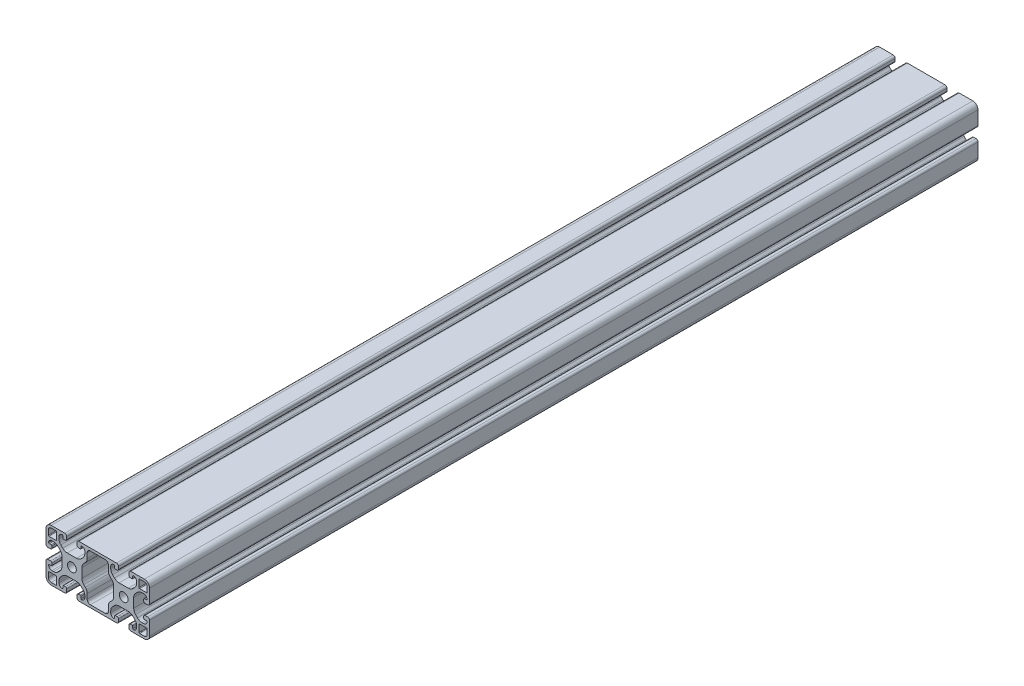
from build123d import *

# Parameters (mm, degrees)
ESQUISSE1_R        = 3.4
BOSS_EXTRU_1_DEPTH = 640


with BuildPart() as part:
    # Esquisse1 → Boss.-Extru.1 (new body)
    with BuildSketch(Plane.XY.offset(20)):
        with BuildLine():
            Line((66.5, 4.5), (65, 4.5))
            ThreePointArc((65, 4.5), (64.292893219, 4.207106781), (64, 3.5))
            Line((64, 3.5), (64, 1.5))
            ThreePointArc((64, 1.5), (64.439339828, 0.439339828), (65.5, 0))
            Line((65.5, 0), (76, 0))
            ThreePointArc((76, 0), (78.828427125, 1.171572875), (80, 4))
            Line((80, 4), (80, 14.5))
            ThreePointArc((80, 14.5), (79.560660172, 15.560660172), (78.5, 16))
            Line((78.5, 16), (76.5, 16))
            ThreePointArc((76.5, 16), (75.792893219, 15.707106781), (75.5, 15))
            Line((75.5, 15), (75.5, 13.5))
            ThreePointArc((75.5, 13.5), (75.646446609, 13.146446609), (76, 13))
            Line((76, 13), (77.5, 13))
            ThreePointArc((77.5, 13), (77.853553391, 12.853553391), (78, 12.5))
            ThreePointArc((78, 12.5), (77.267766953, 10.732233047), (75.5, 10))
            Line((75.5, 10), (74.192388155, 10))
            ThreePointArc((74.192388155, 10), (72.278970994, 10.380602337), (70.656854249, 11.464466094))
            Line((70.656854249, 11.464466094), (69.214466094, 12.906854249))
            ThreePointArc((69.214466094, 12.906854249), (68.130602337, 14.528970994), (67.75, 16.442388155))
            Line((67.75, 16.442388155), (67.75, 23.557611845))
            ThreePointArc((67.75, 23.557611845), (68.130602337, 25.471029006), (69.214466094, 27.093145751))
            Line((69.214466094, 27.093145751), (70.656854249, 28.535533906))
            ThreePointArc((70.656854249, 28.535533906), (72.278970994, 29.619397663), (74.192388155, 30))
            Line((74.192388155, 30), (75.5, 30))
            ThreePointArc((75.5, 30), (77.267766953, 29.267766953), (78, 27.5))
            ThreePointArc((78, 27.5), (77.853553391, 27.146446609), (77.5, 27))
            Line((77.5, 27), (76, 27))
            ThreePointArc((76, 27), (75.646446609, 26.853553391), (75.5, 26.5))
            Line((75.5, 26.5), (75.5, 25))
            ThreePointArc((75.5, 25), (75.792893219, 24.292893219), (76.5, 24))
            Line((76.5, 24), (78.5, 24))
            ThreePointArc((78.5, 24), (79.560660172, 24.439339828), (80, 25.5))
            Line((80, 25.5), (80, 36))
            ThreePointArc((80, 36), (78.828427125, 38.828427125), (76, 40))
            Line((76, 40), (65.5, 40))
            ThreePointArc((65.5, 40), (64.439339828, 39.560660172), (64, 38.5))
            Line((64, 38.5), (64, 36.5))
            ThreePointArc((64, 36.5), (64.292893219, 35.792893219), (65, 35.5))
            Line((65, 35.5), (66.5, 35.5))
            ThreePointArc((66.5, 35.5), (66.853553391, 35.646446609), (67, 36))
            Line((67, 36), (67, 37.5))
            ThreePointArc((67, 37.5), (67.146446609, 37.853553391), (67.5, 38))
            ThreePointArc((67.5, 38), (69.267766953, 37.267766953), (70, 35.5))
            Line((70, 35.5), (70, 34.192388155))
            ThreePointArc((70, 34.192388155), (69.619397663, 32.278970994), (68.535533906, 30.656854249))
            Line((68.535533906, 30.656854249), (67.093145751, 29.214466094))
            ThreePointArc((67.093145751, 29.214466094), (65.471029006, 28.130602337), (63.557611845, 27.75))
            Line((63.557611845, 27.75), (56.442388155, 27.75))
            ThreePointArc((56.442388155, 27.75), (54.528970994, 28.130602337), (52.906854249, 29.214466094))
            Line((52.906854249, 29.214466094), (51.464466094, 30.656854249))
            ThreePointArc((51.464466094, 30.656854249), (50.380602337, 32.278970994), (50, 34.192388155))
            Line((50, 34.192388155), (50, 35.5))
            ThreePointArc((50, 35.5), (50.732233047, 37.267766953), (52.5, 38))
            ThreePointArc((52.5, 38), (52.853553391, 37.853553391), (53, 37.5))
            Line((53, 37.5), (53, 36))
            ThreePointArc((53, 36), (53.146446609, 35.646446609), (53.5, 35.5))
            Line((53.5, 35.5), (55, 35.5))
            ThreePointArc((55, 35.5), (55.707106781, 35.792893219), (56, 36.5))
            Line((56, 36.5), (56, 38.5))
            ThreePointArc((56, 38.5), (55.560660172, 39.560660172), (54.5, 40))
            Line((54.5, 40), (25.5, 40))
            ThreePointArc((25.5, 40), (24.439339828, 39.560660172), (24, 38.5))
            Line((24, 38.5), (24, 36.5))
            ThreePointArc((24, 36.5), (24.292893219, 35.792893219), (25, 35.5))
            Line((25, 35.5), (26.5, 35.5))
            ThreePointArc((26.5, 35.5), (26.853553391, 35.646446609), (27, 36))
            Line((27, 36), (27, 37.5))
            ThreePointArc((27, 37.5), (27.146446609, 37.853553391), (27.5, 38))
            ThreePointArc((27.5, 38), (29.267766953, 37.267766953), (30, 35.5))
            Line((30, 35.5), (30, 34.192388155))
            ThreePointArc((30, 34.192388155), (29.619397663, 32.278970994), (28.535533906, 30.656854249))
            Line((28.535533906, 30.656854249), (27.093145751, 29.214466094))
            ThreePointArc((27.093145751, 29.214466094), (25.471029006, 28.130602337), (23.557611845, 27.75))
            Line((23.557611845, 27.75), (16.442388155, 27.75))
            ThreePointArc((16.442388155, 27.75), (14.528970994, 28.130602337), (12.906854249, 29.214466094))
            Line((12.906854249, 29.214466094), (11.464466094, 30.656854249))
            ThreePointArc((11.464466094, 30.656854249), (10.380602337, 32.278970994), (10, 34.192388155))
            Line((10, 34.192388155), (10, 35.5))
            ThreePointArc((10, 35.5), (10.732233047, 37.267766953), (12.5, 38))
            ThreePointArc((12.5, 38), (12.853553391, 37.853553391), (13, 37.5))
            Line((13, 37.5), (13, 36))
            ThreePointArc((13, 36), (13.146446609, 35.646446609), (13.5, 35.5))
            Line((13.5, 35.5), (15, 35.5))
            ThreePointArc((15, 35.5), (15.707106781, 35.792893219), (16, 36.5))
            Line((16, 36.5), (16, 38.5))
            ThreePointArc((16, 38.5), (15.560660172, 39.560660172), (14.5, 40))
            Line((14.5, 40), (4, 40))
            ThreePointArc((4, 40), (1.171572875, 38.828427125), (0, 36))
            Line((0, 36), (0, 25.5))
            ThreePointArc((0, 25.5), (0.439339828, 24.439339828), (1.5, 24))
            Line((1.5, 24), (3.5, 24))
            ThreePointArc((3.5, 24), (4.207106781, 24.292893219), (4.5, 25))
            Line((4.5, 25), (4.5, 26.5))
            ThreePointArc((4.5, 26.5), (4.353553391, 26.853553391), (4, 27))
            Line((4, 27), (2.5, 27))
            ThreePointArc((2.5, 27), (2.146446609, 27.146446609), (2, 27.5))
            ThreePointArc((2, 27.5), (2.732233047, 29.267766953), (4.5, 30))
            Line((4.5, 30), (5.807611845, 30))
            ThreePointArc((5.807611845, 30), (7.721029006, 29.619397663), (9.343145751, 28.535533906))
            Line((9.343145751, 28.535533906), (10.785533906, 27.093145751))
            ThreePointArc((10.785533906, 27.093145751), (11.869397663, 25.471029006), (12.25, 23.557611845))
            Line((12.25, 23.557611845), (12.25, 16.442388155))
            ThreePointArc((12.25, 16.442388155), (11.869397663, 14.528970994), (10.785533906, 12.906854249))
            Line((10.785533906, 12.906854249), (9.343145751, 11.464466094))
            ThreePointArc((9.343145751, 11.464466094), (7.721029006, 10.380602337), (5.807611845, 10))
            Line((5.807611845, 10), (4.5, 10))
            ThreePointArc((4.5, 10), (2.732233047, 10.732233047), (2, 12.5))
            ThreePointArc((2, 12.5), (2.146446609, 12.853553391), (2.5, 13))
            Line((2.5, 13), (4, 13))
            ThreePointArc((4, 13), (4.353553391, 13.146446609), (4.5, 13.5))
            Line((4.5, 13.5), (4.5, 15))
            ThreePointArc((4.5, 15), (4.207106781, 15.707106781), (3.5, 16))
            Line((3.5, 16), (1.5, 16))
            ThreePointArc((1.5, 16), (0.439339828, 15.560660172), (0, 14.5))
            Line((0, 14.5), (0, 4))
            ThreePointArc((0, 4), (1.171572875, 1.171572875), (4, 0))
            Line((4, 0), (14.5, 0))
            ThreePointArc((14.5, 0), (15.560660172, 0.439339828), (16, 1.5))
            Line((16, 1.5), (16, 3.5))
            ThreePointArc((16, 3.5), (15.707106781, 4.207106781), (15, 4.5))
            Line((15, 4.5), (13.5, 4.5))
            ThreePointArc((13.5, 4.5), (13.146446609, 4.353553391), (13, 4))
            Line((13, 4), (13, 2.5))
            ThreePointArc((13, 2.5), (12.853553391, 2.146446609), (12.5, 2))
            ThreePointArc((12.5, 2), (10.732233047, 2.732233047), (10, 4.5))
            Line((10, 4.5), (10, 5.807611845))
            ThreePointArc((10, 5.807611845), (10.380602337, 7.721029006), (11.464466094, 9.343145751))
            Line((11.464466094, 9.343145751), (12.906854249, 10.785533906))
            ThreePointArc((12.906854249, 10.785533906), (14.528970994, 11.869397663), (16.442388155, 12.25))
            Line((16.442388155, 12.25), (23.557611845, 12.25))
            ThreePointArc((23.557611845, 12.25), (25.471029006, 11.869397663), (27.093145751, 10.785533906))
            Line((27.093145751, 10.785533906), (28.535533906, 9.343145751))
            ThreePointArc((28.535533906, 9.343145751), (29.619397663, 7.721029006), (30, 5.807611845))
            Line((30, 5.807611845), (30, 4.5))
            ThreePointArc((30, 4.5), (29.267766953, 2.732233047), (27.5, 2))
            ThreePointArc((27.5, 2), (27.146446609, 2.146446609), (27, 2.5))
            Line((27, 2.5), (27, 4))
            ThreePointArc((27, 4), (26.853553391, 4.353553391), (26.5, 4.5))
            Line((26.5, 4.5), (25, 4.5))
            ThreePointArc((25, 4.5), (24.292893219, 4.207106781), (24, 3.5))
            Line((24, 3.5), (24, 1.5))
            ThreePointArc((24, 1.5), (24.439339828, 0.439339828), (25.5, 0))
            Line((25.5, 0), (54.5, 0))
            ThreePointArc((54.5, 0), (55.560660172, 0.439339828), (56, 1.5))
            Line((56, 1.5), (56, 3.5))
            ThreePointArc((56, 3.5), (55.707106781, 4.207106781), (55, 4.5))
            Line((55, 4.5), (53.5, 4.5))
            ThreePointArc((53.5, 4.5), (53.146446609, 4.353553391), (53, 4))
            Line((53, 4), (53, 2.5))
            ThreePointArc((53, 2.5), (52.853553391, 2.146446609), (52.5, 2))
            ThreePointArc((52.5, 2), (50.732233047, 2.732233047), (50, 4.5))
            Line((50, 4.5), (50, 5.807611845))
            ThreePointArc((50, 5.807611845), (50.380602337, 7.721029006), (51.464466094, 9.343145751))
            Line((51.464466094, 9.343145751), (52.906854249, 10.785533906))
            ThreePointArc((52.906854249, 10.785533906), (54.528970994, 11.869397663), (56.442388155, 12.25))
            Line((56.442388155, 12.25), (63.557611845, 12.25))
            ThreePointArc((63.557611845, 12.25), (65.471029006, 11.869397663), (67.093145751, 10.785533906))
            Line((67.093145751, 10.785533906), (68.535533906, 9.343145751))
            ThreePointArc((68.535533906, 9.343145751), (69.619397663, 7.721029006), (70, 5.807611845))
            Line((70, 5.807611845), (70, 4.5))
            ThreePointArc((70, 4.5), (69.267766953, 2.732233047), (67.5, 2))
            ThreePointArc((67.5, 2), (67.146446609, 2.146446609), (67, 2.5))
            Line((67, 2.5), (67, 4))
            ThreePointArc((67, 4), (66.853553391, 4.353553391), (66.5, 4.5))
        make_face()
        with Locations(Location((20, 20, 0), (0, 0, 180))):
            Circle(ESQUISSE1_R, mode=Mode.SUBTRACT)
        with Locations(Location((60, 20, 0), (0, 0, 180))):
            Circle(ESQUISSE1_R, mode=Mode.SUBTRACT)
        with BuildLine():
            Line((31.8, 4.5), (31.8, 8.250252532))
            ThreePointArc((31.8, 8.250252532), (31.419397663, 10.163669694), (30.335533906, 11.785786438))
            Line((30.335533906, 11.785786438), (29.214466094, 12.906854249))
            ThreePointArc((29.214466094, 12.906854249), (28.130602337, 14.528970994), (27.75, 16.442388155))
            Line((27.75, 16.442388155), (27.75, 23.557611845))
            ThreePointArc((27.75, 23.557611845), (28.130602337, 25.471029006), (29.214466094, 27.093145751))
            Line((29.214466094, 27.093145751), (30.335533906, 28.214213562))
            ThreePointArc((30.335533906, 28.214213562), (31.419397663, 29.836330306), (31.8, 31.749747468))
            Line((31.8, 31.749747468), (31.8, 35.5))
            ThreePointArc((31.8, 35.5), (32.532233047, 37.267766953), (34.3, 38))
            Line((34.3, 38), (45.7, 38))
            ThreePointArc((45.7, 38), (47.467766953, 37.267766953), (48.2, 35.5))
            Line((48.2, 35.5), (48.2, 31.749747468))
            ThreePointArc((48.2, 31.749747468), (48.580602337, 29.836330306), (49.664466094, 28.214213562))
            Line((49.664466094, 28.214213562), (50.785533906, 27.093145751))
            ThreePointArc((50.785533906, 27.093145751), (51.869397663, 25.471029006), (52.25, 23.557611845))
            Line((52.25, 23.557611845), (52.25, 16.442388155))
            ThreePointArc((52.25, 16.442388155), (51.869397663, 14.528970994), (50.785533906, 12.906854249))
            Line((50.785533906, 12.906854249), (49.664466094, 11.785786438))
            ThreePointArc((49.664466094, 11.785786438), (48.580602337, 10.163669694), (48.2, 8.250252532))
            Line((48.2, 8.250252532), (48.2, 4.5))
            ThreePointArc((48.2, 4.5), (47.467766953, 2.732233047), (45.7, 2))
            Line((45.7, 2), (34.3, 2))
            ThreePointArc((34.3, 2), (32.532233047, 2.732233047), (31.8, 4.5))
        make_face(mode=Mode.SUBTRACT)
        with BuildLine():
            Line((7.7, 1.8), (4, 1.8))
            ThreePointArc((4, 1.8), (2.444365081, 2.444365081), (1.8, 4))
            Line((1.8, 4), (1.8, 7.7))
            ThreePointArc((1.8, 7.7), (1.946446609, 8.053553391), (2.3, 8.2))
            Line((2.3, 8.2), (7.7, 8.2))
            ThreePointArc((7.7, 8.2), (8.053553391, 8.053553391), (8.2, 7.7))
            Line((8.2, 7.7), (8.2, 2.3))
            ThreePointArc((8.2, 2.3), (8.053553391, 1.946446609), (7.7, 1.8))
        make_face(mode=Mode.SUBTRACT)
        with BuildLine():
            Line((72.3, 38.2), (76, 38.2))
            ThreePointArc((76, 38.2), (77.555634919, 37.555634919), (78.2, 36))
            Line((78.2, 36), (78.2, 32.3))
            ThreePointArc((78.2, 32.3), (78.053553391, 31.946446609), (77.7, 31.8))
            Line((77.7, 31.8), (72.3, 31.8))
            ThreePointArc((72.3, 31.8), (71.946446609, 31.946446609), (71.8, 32.3))
            Line((71.8, 32.3), (71.8, 37.7))
            ThreePointArc((71.8, 37.7), (71.946446609, 38.053553391), (72.3, 38.2))
        make_face(mode=Mode.SUBTRACT)
        with BuildLine():
            Line((78.2, 7.7), (78.2, 4))
            ThreePointArc((78.2, 4), (77.555634919, 2.444365081), (76, 1.8))
            Line((76, 1.8), (72.3, 1.8))
            ThreePointArc((72.3, 1.8), (71.946446609, 1.946446609), (71.8, 2.3))
            Line((71.8, 2.3), (71.8, 7.7))
            ThreePointArc((71.8, 7.7), (71.946446609, 8.053553391), (72.3, 8.2))
            Line((72.3, 8.2), (77.7, 8.2))
            ThreePointArc((77.7, 8.2), (78.053553391, 8.053553391), (78.2, 7.7))
        make_face(mode=Mode.SUBTRACT)
        with BuildLine():
            Line((1.8, 32.3), (1.8, 36))
            ThreePointArc((1.8, 36), (2.444365081, 37.555634919), (4, 38.2))
            Line((4, 38.2), (7.7, 38.2))
            ThreePointArc((7.7, 38.2), (8.053553391, 38.053553391), (8.2, 37.7))
            Line((8.2, 37.7), (8.2, 32.3))
            ThreePointArc((8.2, 32.3), (8.053553391, 31.946446609), (7.7, 31.8))
            Line((7.7, 31.8), (2.3, 31.8))
            ThreePointArc((2.3, 31.8), (1.946446609, 31.946446609), (1.8, 32.3))
        make_face(mode=Mode.SUBTRACT)
    extrude(amount=-BOSS_EXTRU_1_DEPTH)


solid = part.part
